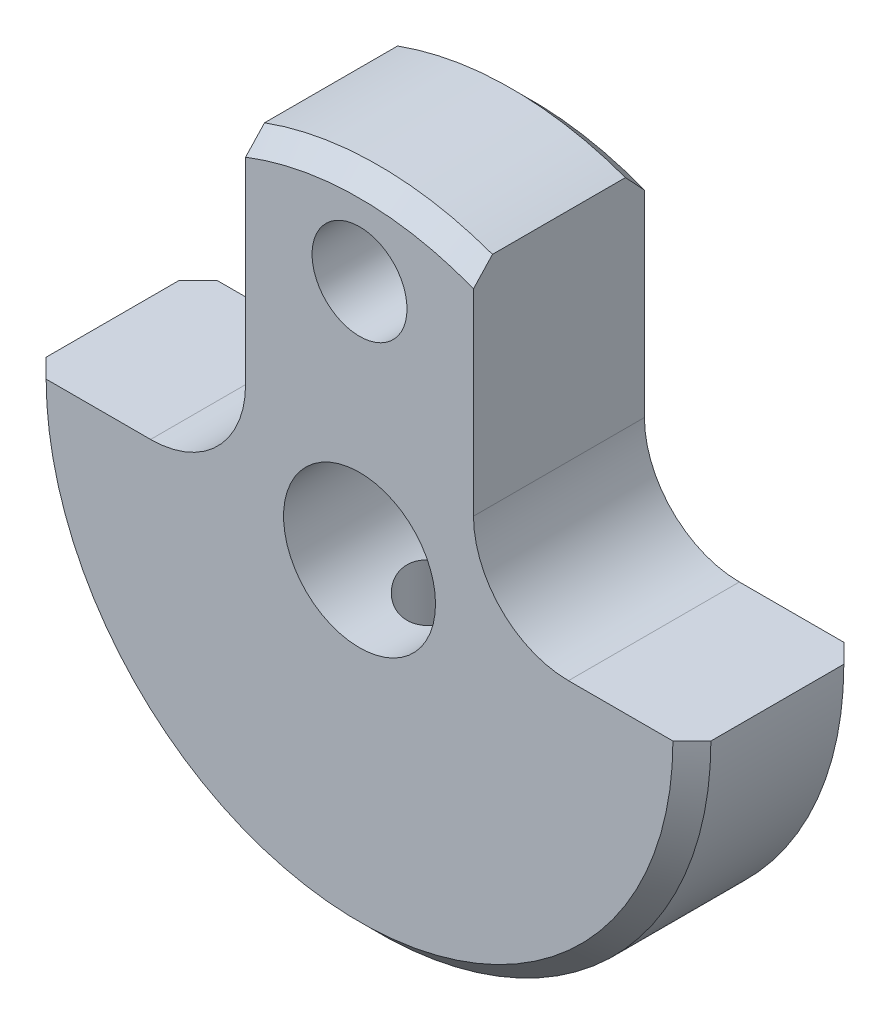
from build123d import *

# Parameters (mm, degrees)
BOSS_EXTRUDE1_DEPTH = 4.5
SKETCH2_R           = 4
SKETCH2_R_2         = 2.5
CUT_EXTRUDE1_DEPTH  = 9
SKETCH3_R           = 2
CUT_EXTRUDE2_DEPTH  = 26.154522456
CHAMFER1_SIZE       = 1


with BuildPart() as part:
    # Sketch1 → Boss-Extrude1 (new, symmetric)
    with BuildSketch(Plane.XY):
        with BuildLine():
            Line((6, 16.439282223), (6, 5))
            ThreePointArc((6, 5), (7.464466094, 1.464466094), (11, 0))
            Line((11, 0), (17.5, 0))
            ThreePointArc((17.5, 0), (0, -17.5), (-17.5, 0))
            Line((-17.5, 0), (-11, 0))
            ThreePointArc((-11, 0), (-7.464466094, 1.464466094), (-6, 5))
            Line((-6, 5), (-6, 16.439282223))
            ThreePointArc((-6, 16.439282223), (0, 17.5), (6, 16.439282223))
        make_face()
    extrude(amount=BOSS_EXTRUDE1_DEPTH, both=True)

    # Sketch2 → Cut-Extrude1 (cut)
    with BuildSketch(Plane.XY.offset(4.5)):
        Circle(SKETCH2_R)
        with Locations((0, 12.7)):
            Circle(SKETCH2_R_2)
    extrude(amount=-CUT_EXTRUDE1_DEPTH, mode=Mode.SUBTRACT)

    # Sketch3 → Cut-Extrude2 (cut, through all)
    with BuildSketch(Plane(origin=(0, 0, 0), x_dir=(1, 0, 0), z_dir=(0, 1, 0))):
        with Locations(Location((0, 0, 0), (0, 0, 270))):
            Circle(SKETCH3_R)
    extrude(amount=-CUT_EXTRUDE2_DEPTH, mode=Mode.SUBTRACT)

    # Chamfer1
    chamfer1_edges = [part.edges().sort_by_distance(p)[0] for p in [
        (0, 17.5, -4.5),
        (0, -17.5, 4.5),
        (0, 17.5, 4.5),
        (0, -17.5, -4.5),
    ]]
    chamfer(chamfer1_edges, length=CHAMFER1_SIZE)


solid = part.part
